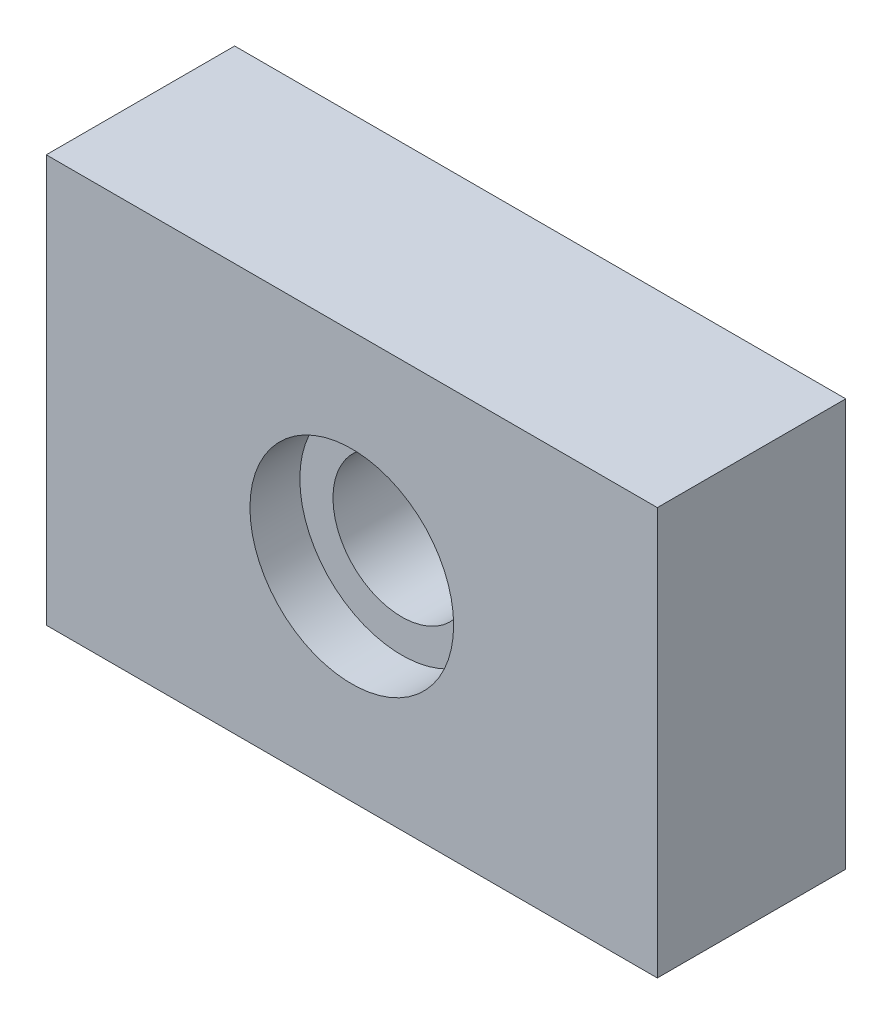
from build123d import *

# Parameters (mm, degrees)
SKETCH1_W                       = 152.4
SKETCH1_H                       = 101.6
BOSS_EXTRUDE1_DEPTH             = 46.99
SKETCH2_R                       = 17.145
CUT_EXTRUDE1_DEPTH              = 190.093574983
SKETCH2_2_R                     = 25.4
SKETCH2_2_R_2                   = 17.145
CUT_EXTRUDE3_DEPTH              = 12.446
TAP_DRILL_FOR_1_2_13_TAP1_D     = 10.71626
TAP_DRILL_FOR_1_2_13_TAP1_DEPTH = 17.78
TAP_DRILL_FOR_1_2_13_TAP1_TIP   = 3.219489309


with BuildPart() as part:
    # Sketch1 → Boss-Extrude1 (new body)
    with BuildSketch(Plane.XY):
        with Locations((76.2, 50.8)):
            Rectangle(SKETCH1_W, SKETCH1_H)
    extrude(amount=BOSS_EXTRUDE1_DEPTH)

    # Sketch2 → Cut-Extrude1 (cut, through all)
    with BuildSketch(Plane(origin=(0, 0, 0), x_dir=(-1, 0, 0), z_dir=(0, 0, -1))):
        with Locations((-76.2, 50.8)):
            Circle(SKETCH2_R)
    extrude(amount=-CUT_EXTRUDE1_DEPTH, mode=Mode.SUBTRACT)

    # Sketch2<2> → Cut-Extrude3 (cut)
    with BuildSketch(Plane(origin=(0, 0, 0), x_dir=(-1, 0, 0), z_dir=(0, 0, -1))):
        with Locations((-76.2, 50.8)):
            Circle(SKETCH2_2_R)
        with Locations((-76.2, 50.8)):
            Circle(SKETCH2_2_R_2, mode=Mode.SUBTRACT)
    cut_extrude3 = extrude(amount=-CUT_EXTRUDE3_DEPTH, mode=Mode.SUBTRACT)

    # Mirror2: Cut-Extrude3 across plane
    add(cut_extrude3.mirror(Plane(origin=(0, 0, 23.495), x_dir=(1, 0, 0), z_dir=(0, 0, -1))), mode=Mode.SUBTRACT)

    # Tap Drill for 1/2-13 Tap1
    with Locations(Plane(origin=(0, 0, 0), x_dir=(-1, 0, 0), z_dir=(0, -1, 0))):
        with Locations((-66.653283, -23.495), (-28.553283, -23.495)):
            Hole(TAP_DRILL_FOR_1_2_13_TAP1_D / 2, depth=TAP_DRILL_FOR_1_2_13_TAP1_DEPTH)
            with Locations((0, 0, -(TAP_DRILL_FOR_1_2_13_TAP1_DEPTH + TAP_DRILL_FOR_1_2_13_TAP1_TIP / 2))):  # 118° drill point
                Cone(0, TAP_DRILL_FOR_1_2_13_TAP1_D / 2, TAP_DRILL_FOR_1_2_13_TAP1_TIP, mode=Mode.SUBTRACT)


solid = part.part
